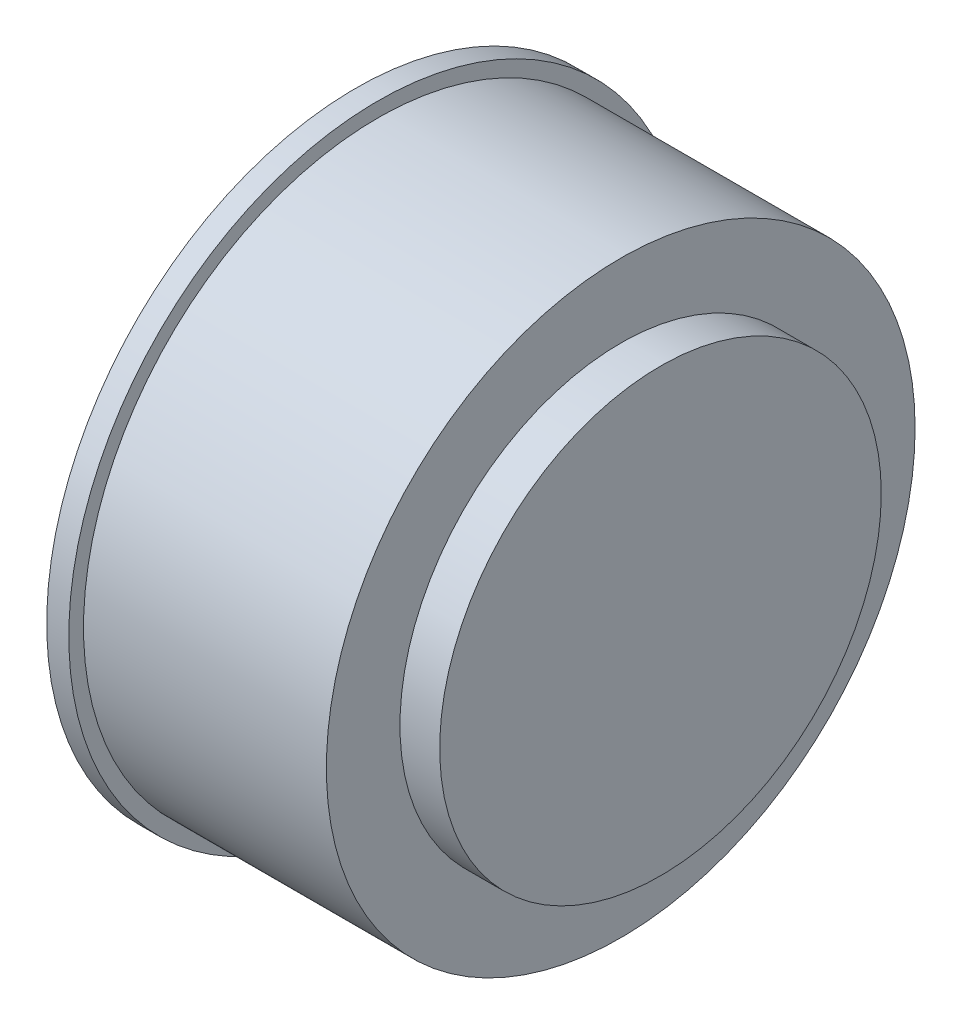
from build123d import *

# Parameters (mm, degrees)
SKETCH3_R          = 1.5
CUT_EXTRUDE1_DEPTH = 4


with BuildPart() as part:
    # Sketch2 → Revolve1 (revolve)
    with BuildSketch(Plane(origin=(0, 0, 0), x_dir=(1, 0, 0), z_dir=(0, 1, 0))):
        Polygon((0, 0), (0, 15), (-2.7, 15), (-2.7, 20), (-19.2, 20), (-19.2, 21), (-20.7, 21), (-20.7, 17.652837292), (-20.7, 14.5), (-20.7, 8), (-15.7, 8), (-15.7, 6), (-14.7, 6), (-14.7, 0), align=None)
    revolve(axis=Axis((0, 0, 0), (-1, 0, 0)))

    # Sketch3 → Cut-Extrude1 (cut)
    with BuildSketch(Plane.ZY.offset(20.7)):
        with Locations((0, 16)):
            Circle(SKETCH3_R)
        with Locations((13.856406461, 7.904729806)):
            Circle(SKETCH3_R)
        with Locations((13.773900052, -8.142905292)):
            Circle(SKETCH3_R)
        with Locations((-0.165012817, -16.095270194)):
            Circle(SKETCH3_R)
        with Locations((-14.021419278, -8)):
            Circle(SKETCH3_R)
        with Locations((-13.938912869, 8.047635097)):
            Circle(SKETCH3_R)
    extrude(amount=-CUT_EXTRUDE1_DEPTH, mode=Mode.SUBTRACT)


solid = part.part
